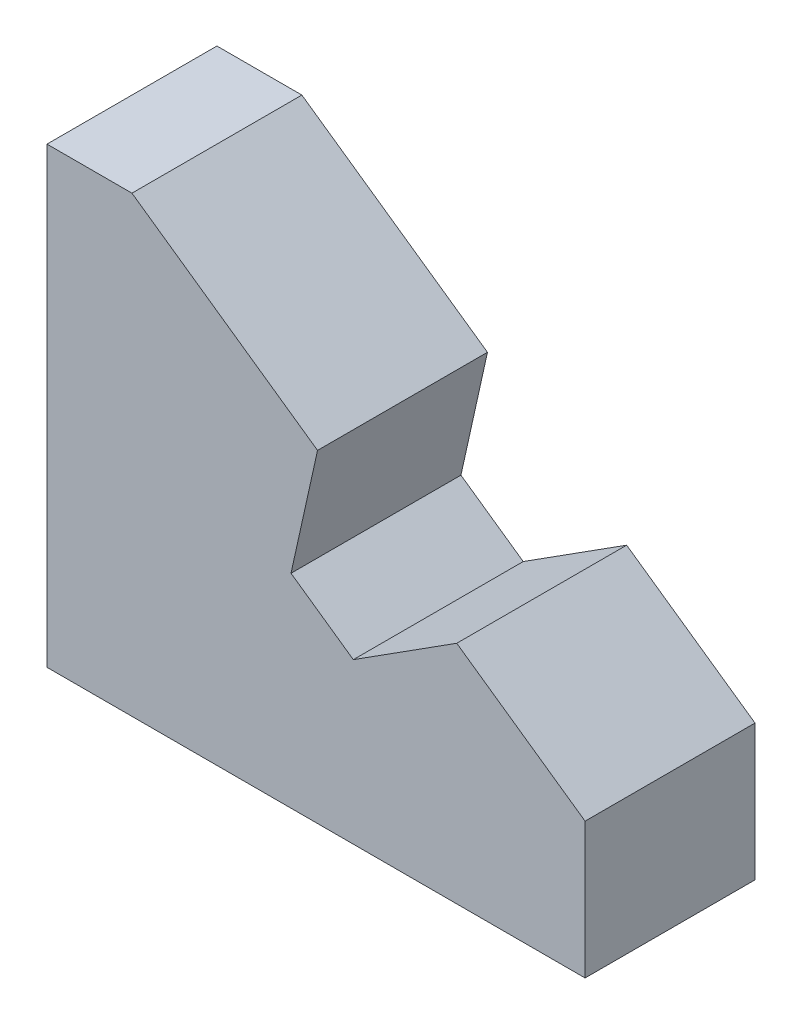
from build123d import *

# Parameters (mm, degrees)
BOSS_EXTRUDE1_DEPTH = 30


with BuildPart() as part:
    # Sketch5 → Boss-Extrude1 (new body)
    with BuildSketch(Plane.XY):
        Polygon((0, 0), (0, 80), (15, 80), (47.766081772, 57.056942546), (43.080630772, 35.92223888), (54.083036645, 28.21827135), (72.3406431, 39.849649455), (95, 23.983396943), (95, 0), align=None)
    extrude(amount=BOSS_EXTRUDE1_DEPTH)


solid = part.part
